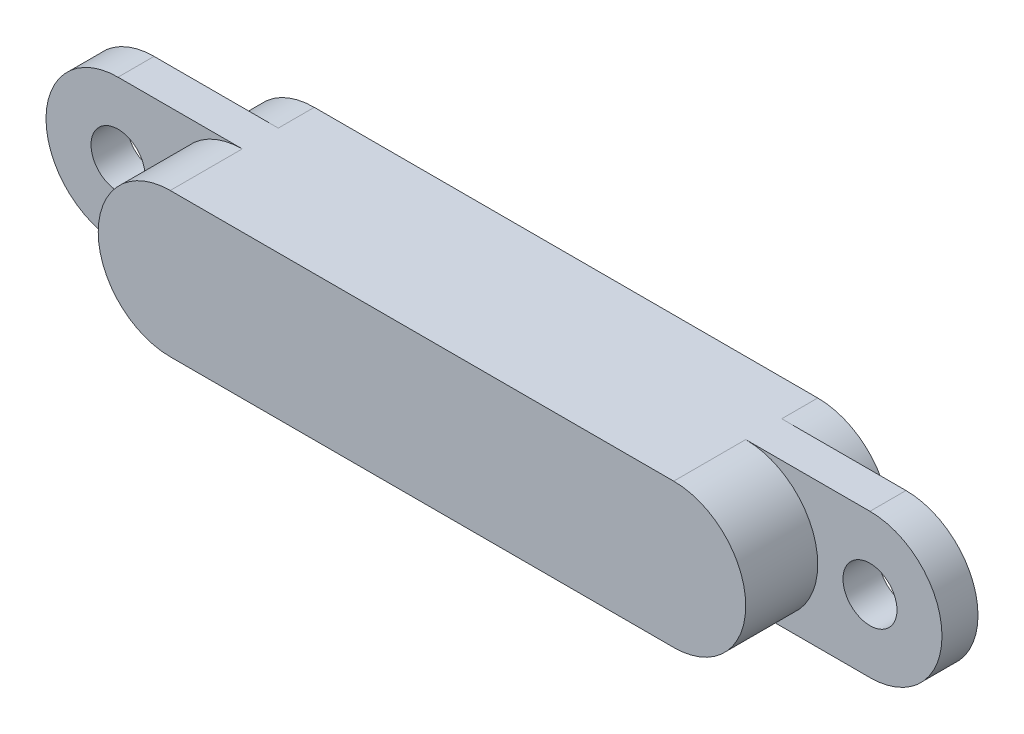
from build123d import *

# Parameters (mm, degrees)
BOSS_EXTRUDE1_DEPTH = 4
SKETCH2_R           = 0.75
CUT_EXTRUDE1_DEPTH  = 4
SKETCH4_R           = 0.75
CUT_EXTRUDE2_DEPTH  = 2
CUT_EXTRUDE3_START  = -3
SKETCH4_3_R         = 0.75
CUT_EXTRUDE3_DEPTH  = 1


with BuildPart() as part:
    # Sketch1 → Boss-Extrude1 (new body)
    with BuildSketch(Plane.XY):
        with BuildLine():
            Line((-10.44, 2), (10.44, 2))
            ThreePointArc((10.44, 2), (12.44, 0), (10.44, -2))
            Line((10.44, -2), (-10.44, -2))
            ThreePointArc((-10.44, -2), (-12.44, 0), (-10.44, 2))
        make_face()
    extrude(amount=BOSS_EXTRUDE1_DEPTH)

    # Sketch2 → Cut-Extrude1 (cut)
    with BuildSketch(Plane.XY.offset(4)):
        with Locations((-10.44, 0)):
            Circle(SKETCH2_R)
        with Locations((10.44, 0)):
            Circle(SKETCH2_R)
    extrude(amount=-CUT_EXTRUDE1_DEPTH, mode=Mode.SUBTRACT)

    # Sketch4 → Cut-Extrude2 (cut)
    # profile 1 of 2: a face of its own
    with BuildSketch(Plane.XY.offset(4)):
        with BuildLine():
            ThreePointArc((-6.99, -2), (-8.99, 0), (-6.99, 2))
            Line((-6.99, 2), (-10.44, 2))
            ThreePointArc((-10.44, 2), (-12.44, 0), (-10.44, -2))
            Line((-10.44, -2), (-6.99, -2))
        make_face()
        with Locations((-10.44, 0)):
            Circle(SKETCH4_R, mode=Mode.SUBTRACT)
    # profile 2 of 2: a face of its own
    with BuildSketch(Plane.XY.offset(4)):
        with BuildLine():
            Line((10.44, 2), (6.99, 2))
            ThreePointArc((6.99, 2), (8.99, 0), (6.99, -2))
            Line((6.99, -2), (10.44, -2))
            ThreePointArc((10.44, -2), (12.44, 0), (10.44, 2))
        make_face()
        with Locations((10.44, 0)):
            Circle(SKETCH4_R, mode=Mode.SUBTRACT)
    extrude(amount=-CUT_EXTRUDE2_DEPTH, mode=Mode.SUBTRACT)

    # Sketch4<3> → Cut-Extrude3 (cut)
    # profile 1 of 2: a face of its own
    with BuildSketch(Plane.XY.offset(4).offset(CUT_EXTRUDE3_START)):
        with BuildLine():
            ThreePointArc((-6.99, -2), (-8.99, 0), (-6.99, 2))
            Line((-6.99, 2), (-10.44, 2))
            ThreePointArc((-10.44, 2), (-12.44, 0), (-10.44, -2))
            Line((-10.44, -2), (-6.99, -2))
        make_face()
        with Locations((-10.44, 0)):
            Circle(SKETCH4_3_R, mode=Mode.SUBTRACT)
    # profile 2 of 2: a face of its own
    with BuildSketch(Plane.XY.offset(4).offset(CUT_EXTRUDE3_START)):
        with BuildLine():
            Line((10.44, 2), (6.99, 2))
            ThreePointArc((6.99, 2), (8.99, 0), (6.99, -2))
            Line((6.99, -2), (10.44, -2))
            ThreePointArc((10.44, -2), (12.44, 0), (10.44, 2))
        make_face()
        with Locations((10.44, 0)):
            Circle(SKETCH4_3_R, mode=Mode.SUBTRACT)
    extrude(amount=-CUT_EXTRUDE3_DEPTH, mode=Mode.SUBTRACT)


solid = part.part
